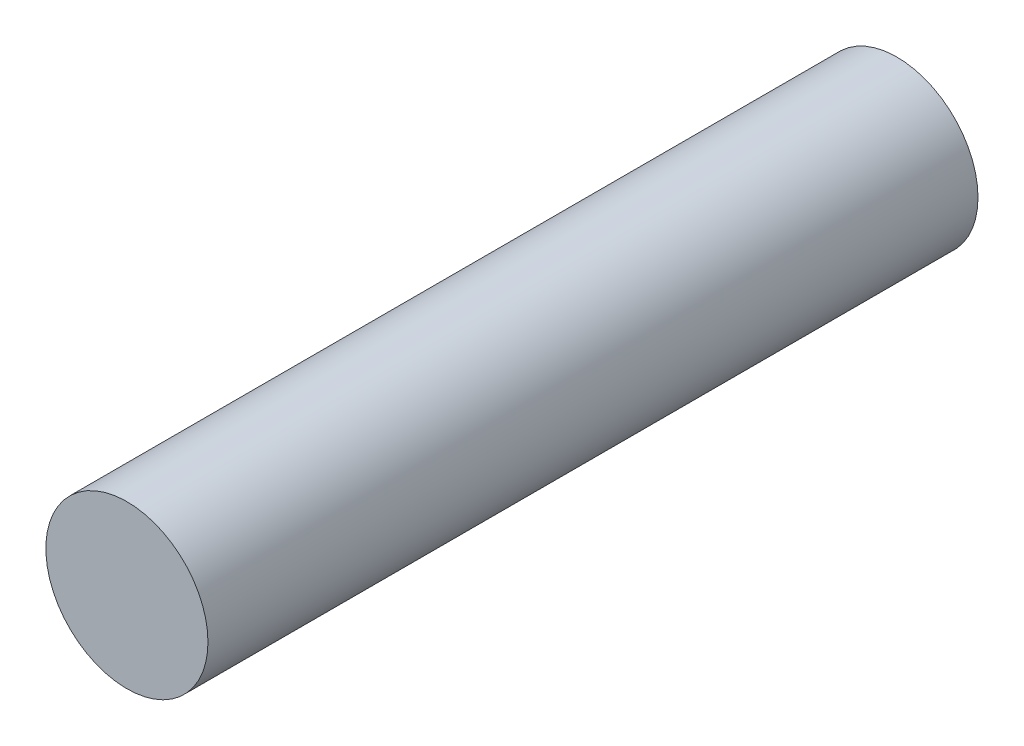
from build123d import *

# Parameters (mm, degrees)
SKETCH_1_R                        = 2
DRIVER_POWER_CABLE_ENVELOPE_DEPTH = 19


with BuildPart() as part:
    # 草图1 → Driver_power_cable_envelope (new body)
    with BuildSketch(Plane.XY):
        Circle(SKETCH_1_R)
    extrude(amount=DRIVER_POWER_CABLE_ENVELOPE_DEPTH)


solid = part.part
